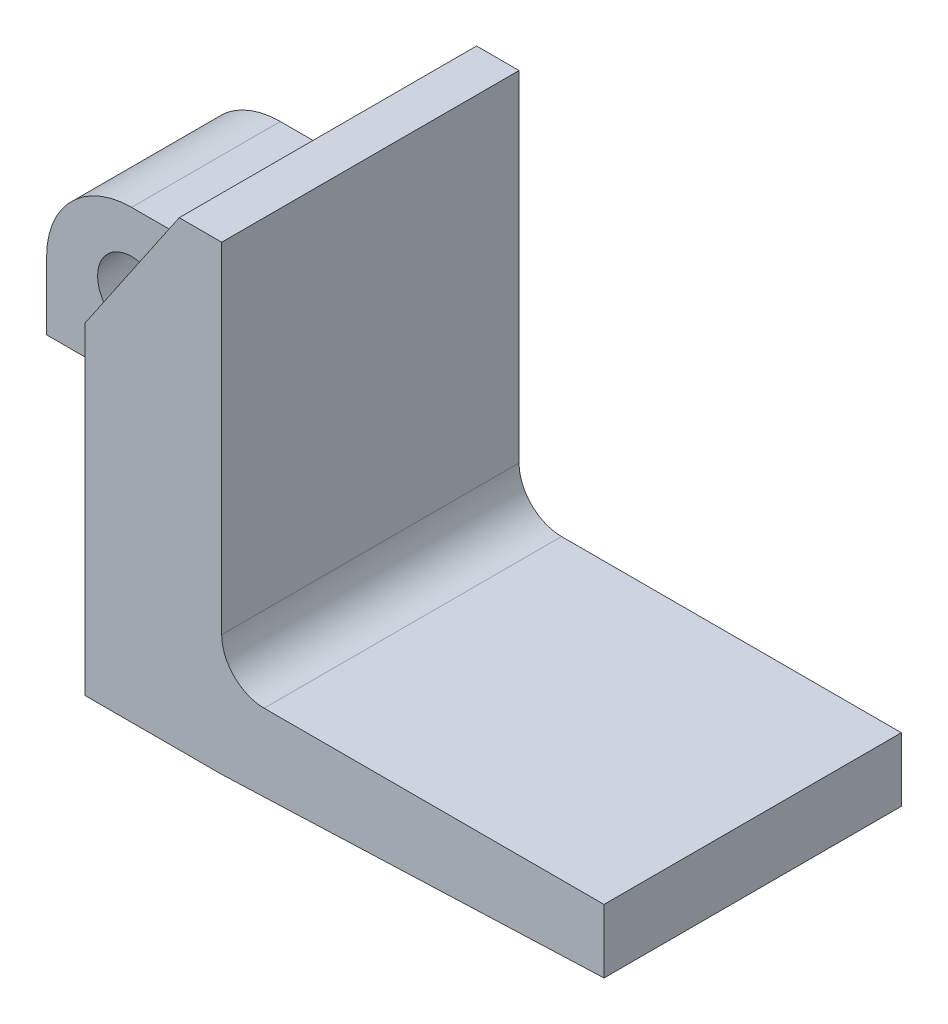
from build123d import *

# Parameters (mm, degrees)
BOSS_EXTRUDE1_DEPTH          = 44.45
FILLET2_R                    = 6.35
CUT_EXTRUDE1_START           = -22.225
CUT_EXTRUDE1_DEPTH           = 22.225
FILLET3_R                    = 2.54
F_3_8_0_375_DIAMETER_HOLE1_D = 10.16


with BuildPart() as part:
    # Sketch1 → Boss-Extrude1 (new body)
    with BuildSketch(Plane.XY):
        with BuildLine():
            Line((0, 0), (57.15, 0))
            Line((57.15, 0), (57.15, -9.525))
            Line((57.15, -9.525), (0, -11.7445024))
            Line((0, -11.7445024), (-20.4502, -11.7445024))
            Line((-20.4502, -11.7445024), (-20.4502, 9.8454976))
            Line((-20.4502, 9.8454976), (-48.3902, 9.8454976))
            Line((-48.3902, 9.8454976), (-48.3902, 20.0054976))
            ThreePointArc((-48.3902, 20.0054976), (-44.670456121, 28.985753721), (-35.6902, 32.7054976))
            Line((-35.6902, 32.7054976), (-22.9902, 32.7054976))
            Line((-22.9902, 32.7054976), (-6.35, 57.15))
            Line((-6.35, 57.15), (0, 57.15))
            Line((0, 57.15), (0, 0))
        make_face()
    extrude(amount=BOSS_EXTRUDE1_DEPTH)

    # Fillet2
    fillet2_edges = [part.edges().sort_by_distance(p)[0] for p in [
        (0, 0, 22.225),
    ]]
    fillet(fillet2_edges, radius=FILLET2_R)

    # Sketch3 → Cut-Extrude1 (cut)
    with BuildSketch(Plane.XY.offset(44.45).offset(CUT_EXTRUDE1_START)):
        with BuildLine():
            Line((-48.3902, 9.8454976), (-20.4502, 9.8454976))
            Line((-20.4502, 9.8454976), (-20.4502, 36.436765018))
            Line((-20.4502, 36.436765018), (-22.9902, 32.7054976))
            Line((-22.9902, 32.7054976), (-35.6902, 32.7054976))
            ThreePointArc((-35.6902, 32.7054976), (-44.670456121, 28.985753721), (-48.3902, 20.0054976))
            Line((-48.3902, 20.0054976), (-48.3902, 9.8454976))
        make_face()
    extrude(amount=CUT_EXTRUDE1_DEPTH, mode=Mode.SUBTRACT)

    # Fillet3
    fillet3_edges = [part.edges().sort_by_distance(p)[0] for p in [
        (-22.9902, 32.7054976, 11.1125),
    ]]
    fillet(fillet3_edges, radius=FILLET3_R)

    # 3/8 (0.375) Diameter Hole1 (through all)
    with Locations(Plane(origin=(0, 0, 0), x_dir=(-1, 0, 0), z_dir=(0, 0, -1))):
        with Locations((35.6902, 21.2754976)):
            Hole(F_3_8_0_375_DIAMETER_HOLE1_D / 2)


solid = part.part
